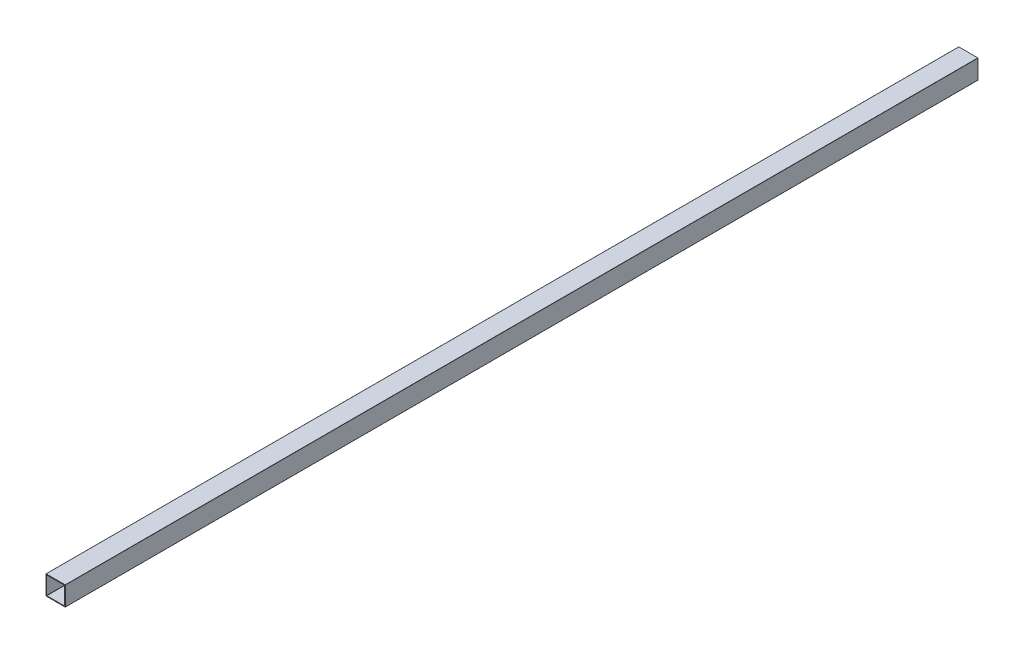
from build123d import *

# Parameters (mm, degrees)
CROQUIS1_W              = 127
CROQUIS1_H              = 127
CROQUIS1_W_2            = 117.9
CROQUIS1_H_2            = 117.9
SALIENTE_EXTRUIR1_DEPTH = 6000
REDONDEO1_R             = 1


with BuildPart() as part:
    # Croquis1 → Saliente-Extruir1 (new body)
    with BuildSketch(Plane.XY):
        Rectangle(CROQUIS1_W, CROQUIS1_H)
        Rectangle(CROQUIS1_W_2, CROQUIS1_H_2, mode=Mode.SUBTRACT)
    extrude(amount=-SALIENTE_EXTRUIR1_DEPTH)

    # Redondeo1
    redondeo1_edges = [part.edges().sort_by_distance(p)[0] for p in [
        (58.95, -58.95, -3000),
        (-58.95, -58.95, -3000),
        (-58.95, 58.95, -3000),
        (58.95, 58.95, -3000),
        (63.5, -63.5, -3000),
        (-63.5, -63.5, -3000),
        (-63.5, 63.5, -3000),
        (63.5, 63.5, -3000),
    ]]
    fillet(redondeo1_edges, radius=REDONDEO1_R)


solid = part.part
